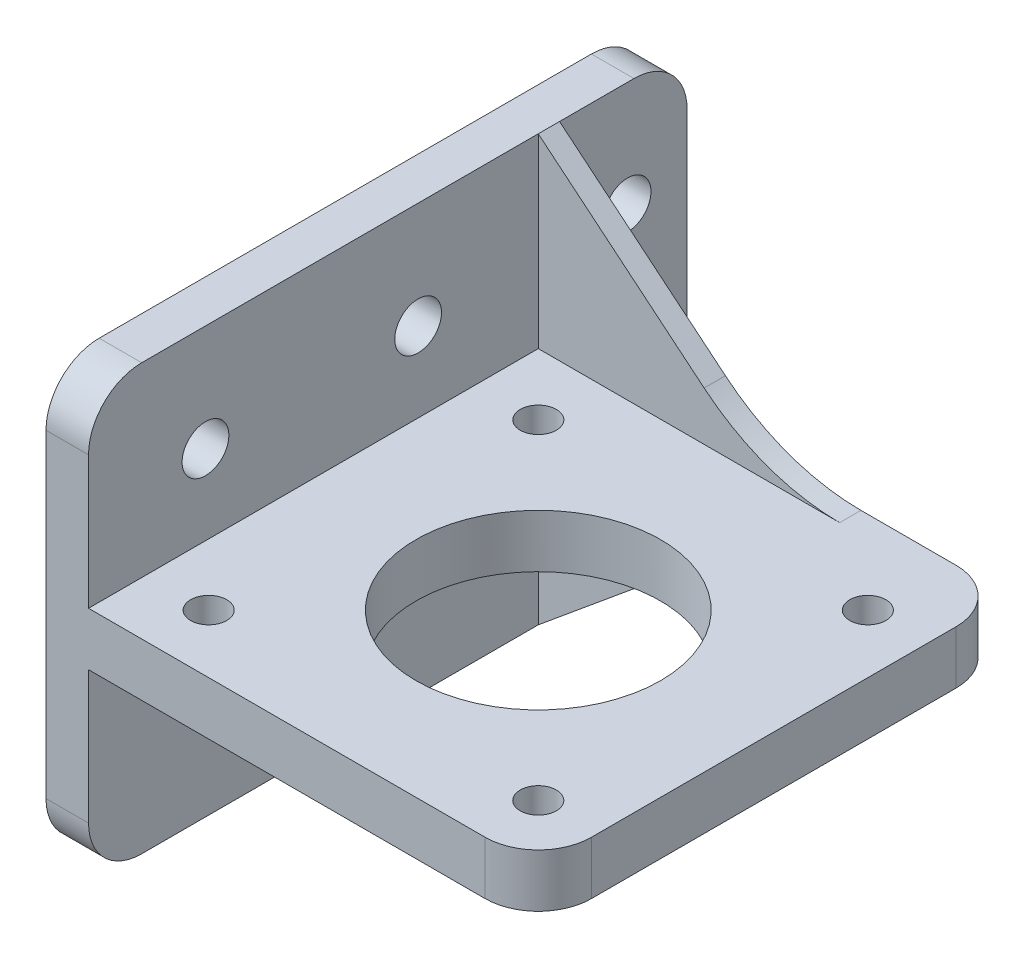
from build123d import *

# Parameters (mm, degrees)
SKETCH_1_W                      = 42.3
SKETCH_1_H                      = 5
SKETCH_1_W_2                    = 21.15
EXTRUDE_1_DEPTH                 = 42.3
CUT_EXTRUDE_1_REACH             = 65.076
SKETCH_2_R                      = 11.5
SKETCH_2_R_2                    = 1.7
CUT_EXTRUDE_1_DIRECTION_2_REACH = 65.076
SKETCH_1_3_W                    = 42.3
SKETCH_1_3_H                    = 5
SKETCH_1_3_W_2                  = 21.15
EXTRUDE_2_DEPTH                 = 2
EXTRUDE_START                   = -2
EXTRUDE_3_DEPTH                 = 12
CUT_EXTRUDE_2_REACH             = 65.076
SKETCH_4_R                      = 2.2
FILLET_1_R                      = 5
FILLET_2_R                      = 20


with BuildPart() as part:
    # 草图1 → 凸台-拉伸1 (new body)
    with BuildSketch(Plane.XY):
        Polygon((0, 2.5), (0, -2.5), (0, -20), (-4, -20), (-4, 20), (0, 20), align=None)
        with Locations((21.15, 0)):
            Rectangle(SKETCH_1_W, SKETCH_1_H)
        Polygon((-4, 0), (0, 0), (0, 2.5), (0, 20), (-4, 20), align=None)
        with Locations((31.725, 0)):
            Rectangle(SKETCH_1_W_2, SKETCH_1_H)
    extrude(amount=EXTRUDE_1_DEPTH)

    # 草图2 → 切除-拉伸1 (cut, up to next)
    with BuildSketch(Plane(origin=(0, 0, 0), x_dir=(1, 0, 0), z_dir=(0, 1, 0)), mode=Mode.PRIVATE) as cut_extrude_1_sk1:
        with Locations(Location((21.3, -21.3, 0), (0, 0, 270))):
            Circle(SKETCH_2_R)
    cut_extrude_1_tool1 = extrude(cut_extrude_1_sk1.sketch, amount=CUT_EXTRUDE_1_REACH, mode=Mode.PRIVATE) & part.part
    # 草图2 → 切除-拉伸1 (cut, up to next)
    with BuildSketch(Plane(origin=(0, 0, 0), x_dir=(1, 0, 0), z_dir=(0, 1, 0)), mode=Mode.PRIVATE) as cut_extrude_1_sk2:
        with Locations(Location((36.8, -5.8, 0), (0, 0, 270))):
            Circle(SKETCH_2_R_2)
    cut_extrude_1_tool2 = extrude(cut_extrude_1_sk2.sketch, amount=CUT_EXTRUDE_1_REACH, mode=Mode.PRIVATE) & part.part
    # 草图2 → 切除-拉伸1 (cut, up to next)
    with BuildSketch(Plane(origin=(0, 0, 0), x_dir=(1, 0, 0), z_dir=(0, 1, 0)), mode=Mode.PRIVATE) as cut_extrude_1_sk3:
        with Locations(Location((36.8, -36.8, 0), (0, 0, 270))):
            Circle(SKETCH_2_R_2)
    cut_extrude_1_tool3 = extrude(cut_extrude_1_sk3.sketch, amount=CUT_EXTRUDE_1_REACH, mode=Mode.PRIVATE) & part.part
    # 草图2 → 切除-拉伸1 (cut, up to next)
    with BuildSketch(Plane(origin=(0, 0, 0), x_dir=(1, 0, 0), z_dir=(0, 1, 0)), mode=Mode.PRIVATE) as cut_extrude_1_sk4:
        with Locations(Location((5.8, -36.8, 0), (0, 0, 270))):
            Circle(SKETCH_2_R_2)
    cut_extrude_1_tool4 = extrude(cut_extrude_1_sk4.sketch, amount=CUT_EXTRUDE_1_REACH, mode=Mode.PRIVATE) & part.part
    # 草图2 → 切除-拉伸1 (cut, up to next)
    with BuildSketch(Plane(origin=(0, 0, 0), x_dir=(1, 0, 0), z_dir=(0, 1, 0)), mode=Mode.PRIVATE) as cut_extrude_1_sk5:
        with Locations(Location((5.8, -5.8, 0), (0, 0, 270))):
            Circle(SKETCH_2_R_2)
    cut_extrude_1_tool5 = extrude(cut_extrude_1_sk5.sketch, amount=CUT_EXTRUDE_1_REACH, mode=Mode.PRIVATE) & part.part
    add(cut_extrude_1_tool1.solids().sort_by_distance((21.3, 0, 21.3))[0], mode=Mode.SUBTRACT)
    add(cut_extrude_1_tool2.solids().sort_by_distance((36.8, 0, 5.8))[0], mode=Mode.SUBTRACT)
    add(cut_extrude_1_tool3.solids().sort_by_distance((36.8, 0, 36.8))[0], mode=Mode.SUBTRACT)
    add(cut_extrude_1_tool4.solids().sort_by_distance((5.8, 0, 36.8))[0], mode=Mode.SUBTRACT)
    add(cut_extrude_1_tool5.solids().sort_by_distance((5.8, 0, 5.8))[0], mode=Mode.SUBTRACT)

    # 草图2 → 切除-拉伸1 direction 2 (cut, up to next)
    with BuildSketch(Plane(origin=(0, 0, 0), x_dir=(1, 0, 0), z_dir=(0, 1, 0)), mode=Mode.PRIVATE) as cut_extrude_1_direction_2_sk1:
        with Locations(Location((21.3, -21.3, 0), (0, 0, 270))):
            Circle(SKETCH_2_R)
    cut_extrude_1_direction_2_tool1 = extrude(cut_extrude_1_direction_2_sk1.sketch, amount=-CUT_EXTRUDE_1_DIRECTION_2_REACH, mode=Mode.PRIVATE) & part.part
    # 草图2 → 切除-拉伸1 direction 2 (cut, up to next)
    with BuildSketch(Plane(origin=(0, 0, 0), x_dir=(1, 0, 0), z_dir=(0, 1, 0)), mode=Mode.PRIVATE) as cut_extrude_1_direction_2_sk2:
        with Locations(Location((36.8, -5.8, 0), (0, 0, 270))):
            Circle(SKETCH_2_R_2)
    cut_extrude_1_direction_2_tool2 = extrude(cut_extrude_1_direction_2_sk2.sketch, amount=-CUT_EXTRUDE_1_DIRECTION_2_REACH, mode=Mode.PRIVATE) & part.part
    # 草图2 → 切除-拉伸1 direction 2 (cut, up to next)
    with BuildSketch(Plane(origin=(0, 0, 0), x_dir=(1, 0, 0), z_dir=(0, 1, 0)), mode=Mode.PRIVATE) as cut_extrude_1_direction_2_sk3:
        with Locations(Location((36.8, -36.8, 0), (0, 0, 270))):
            Circle(SKETCH_2_R_2)
    cut_extrude_1_direction_2_tool3 = extrude(cut_extrude_1_direction_2_sk3.sketch, amount=-CUT_EXTRUDE_1_DIRECTION_2_REACH, mode=Mode.PRIVATE) & part.part
    # 草图2 → 切除-拉伸1 direction 2 (cut, up to next)
    with BuildSketch(Plane(origin=(0, 0, 0), x_dir=(1, 0, 0), z_dir=(0, 1, 0)), mode=Mode.PRIVATE) as cut_extrude_1_direction_2_sk4:
        with Locations(Location((5.8, -36.8, 0), (0, 0, 270))):
            Circle(SKETCH_2_R_2)
    cut_extrude_1_direction_2_tool4 = extrude(cut_extrude_1_direction_2_sk4.sketch, amount=-CUT_EXTRUDE_1_DIRECTION_2_REACH, mode=Mode.PRIVATE) & part.part
    # 草图2 → 切除-拉伸1 direction 2 (cut, up to next)
    with BuildSketch(Plane(origin=(0, 0, 0), x_dir=(1, 0, 0), z_dir=(0, 1, 0)), mode=Mode.PRIVATE) as cut_extrude_1_direction_2_sk5:
        with Locations(Location((5.8, -5.8, 0), (0, 0, 270))):
            Circle(SKETCH_2_R_2)
    cut_extrude_1_direction_2_tool5 = extrude(cut_extrude_1_direction_2_sk5.sketch, amount=-CUT_EXTRUDE_1_DIRECTION_2_REACH, mode=Mode.PRIVATE) & part.part
    add(cut_extrude_1_direction_2_tool1.solids().sort_by_distance((21.3, 0, 21.3))[0], mode=Mode.SUBTRACT)
    add(cut_extrude_1_direction_2_tool2.solids().sort_by_distance((36.8, 0, 5.8))[0], mode=Mode.SUBTRACT)
    add(cut_extrude_1_direction_2_tool3.solids().sort_by_distance((36.8, 0, 36.8))[0], mode=Mode.SUBTRACT)
    add(cut_extrude_1_direction_2_tool4.solids().sort_by_distance((5.8, 0, 36.8))[0], mode=Mode.SUBTRACT)
    add(cut_extrude_1_direction_2_tool5.solids().sort_by_distance((5.8, 0, 5.8))[0], mode=Mode.SUBTRACT)

    # 草图1<3> → 凸台-拉伸2 (add)
    with BuildSketch(Plane.XY):
        Polygon((0, 2.5), (21.15, 2.5), (0, 20), align=None)
        Polygon((21.15, -2.5), (0, -2.5), (0, -20), align=None)
        Polygon((0, -20), (0, -2.5), (0, 0), (-4, 0), (-4, -20), align=None)
        Polygon((-4, 0), (0, 0), (0, 2.5), (0, 20), (-4, 20), align=None)
        with Locations((21.15, 0)):
            Rectangle(SKETCH_1_3_W, SKETCH_1_3_H)
        with Locations((31.725, 0)):
            Rectangle(SKETCH_1_3_W_2, SKETCH_1_3_H)
    extrude(amount=-EXTRUDE_2_DEPTH)

    # 草图1<4> → 凸台-拉伸3 (add)
    with BuildSketch(Plane.XY.offset(EXTRUDE_START)):
        Polygon((-4, 0), (0, 0), (0, 2.5), (0, 20), (-4, 20), align=None)
        Polygon((0, -20), (0, -2.5), (0, 0), (-4, 0), (-4, -20), align=None)
    extrude(amount=-EXTRUDE_3_DEPTH)

    # 草图4 → 切除-拉伸2 (cut, up to next)
    with BuildSketch(Plane(origin=(0, 0, 0), x_dir=(0, 0, -1), z_dir=(1, 0, 0)), mode=Mode.PRIVATE) as cut_extrude_2_sk1:
        with Locations((8.4, 10)):
            Circle(SKETCH_4_R)
    cut_extrude_2_tool1 = extrude(cut_extrude_2_sk1.sketch, amount=-CUT_EXTRUDE_2_REACH, mode=Mode.PRIVATE) & part.part
    # 草图4 → 切除-拉伸2 (cut, up to next)
    with BuildSketch(Plane(origin=(0, 0, 0), x_dir=(0, 0, -1), z_dir=(1, 0, 0)), mode=Mode.PRIVATE) as cut_extrude_2_sk2:
        with Locations(Location((8.4, -10, 0), (0, 0, 90))):
            Circle(SKETCH_4_R)
    cut_extrude_2_tool2 = extrude(cut_extrude_2_sk2.sketch, amount=-CUT_EXTRUDE_2_REACH, mode=Mode.PRIVATE) & part.part
    # 草图4 → 切除-拉伸2 (cut, up to next)
    with BuildSketch(Plane(origin=(0, 0, 0), x_dir=(0, 0, -1), z_dir=(1, 0, 0)), mode=Mode.PRIVATE) as cut_extrude_2_sk3:
        with Locations(Location((-11.3, 10, 0), (0, 0, 90))):
            Circle(SKETCH_4_R)
    cut_extrude_2_tool3 = extrude(cut_extrude_2_sk3.sketch, amount=-CUT_EXTRUDE_2_REACH, mode=Mode.PRIVATE) & part.part
    # 草图4 → 切除-拉伸2 (cut, up to next)
    with BuildSketch(Plane(origin=(0, 0, 0), x_dir=(0, 0, -1), z_dir=(1, 0, 0)), mode=Mode.PRIVATE) as cut_extrude_2_sk4:
        with Locations((-11.3, -10)):
            Circle(SKETCH_4_R)
    cut_extrude_2_tool4 = extrude(cut_extrude_2_sk4.sketch, amount=-CUT_EXTRUDE_2_REACH, mode=Mode.PRIVATE) & part.part
    # 草图4 → 切除-拉伸2 (cut, up to next)
    with BuildSketch(Plane(origin=(0, 0, 0), x_dir=(0, 0, -1), z_dir=(1, 0, 0)), mode=Mode.PRIVATE) as cut_extrude_2_sk5:
        with Locations((-31.3, 10)):
            Circle(SKETCH_4_R)
    cut_extrude_2_tool5 = extrude(cut_extrude_2_sk5.sketch, amount=-CUT_EXTRUDE_2_REACH, mode=Mode.PRIVATE) & part.part
    # 草图4 → 切除-拉伸2 (cut, up to next)
    with BuildSketch(Plane(origin=(0, 0, 0), x_dir=(0, 0, -1), z_dir=(1, 0, 0)), mode=Mode.PRIVATE) as cut_extrude_2_sk6:
        with Locations(Location((-31.3, -10, 0), (0, 0, 90))):
            Circle(SKETCH_4_R)
    cut_extrude_2_tool6 = extrude(cut_extrude_2_sk6.sketch, amount=-CUT_EXTRUDE_2_REACH, mode=Mode.PRIVATE) & part.part
    add(cut_extrude_2_tool1.solids().sort_by_distance((0, 10, -8.4))[0], mode=Mode.SUBTRACT)
    add(cut_extrude_2_tool2.solids().sort_by_distance((0, -10, -8.4))[0], mode=Mode.SUBTRACT)
    add(cut_extrude_2_tool3.solids().sort_by_distance((0, 10, 11.3))[0], mode=Mode.SUBTRACT)
    add(cut_extrude_2_tool4.solids().sort_by_distance((0, -10, 11.3))[0], mode=Mode.SUBTRACT)
    add(cut_extrude_2_tool5.solids().sort_by_distance((0, 10, 31.3))[0], mode=Mode.SUBTRACT)
    add(cut_extrude_2_tool6.solids().sort_by_distance((0, -10, 31.3))[0], mode=Mode.SUBTRACT)

    # 圆角1
    fillet_1_edges = [part.edges().sort_by_distance(p)[0] for p in [
        (42.3, 0, 42.3),
        (-2, 20, 42.3),
        (-2, -20, 42.3),
        (42.3, 0, -2),
        (-2, -20, -14),
        (-2, 20, -14),
    ]]
    fillet(fillet_1_edges, radius=FILLET_1_R)

    # 圆角2
    fillet_2_edges = [part.edges().sort_by_distance(p)[0] for p in [
        (21.15, 2.5, -1),
        (21.15, -2.5, -1),
    ]]
    fillet(fillet_2_edges, radius=FILLET_2_R)


solid = part.part
